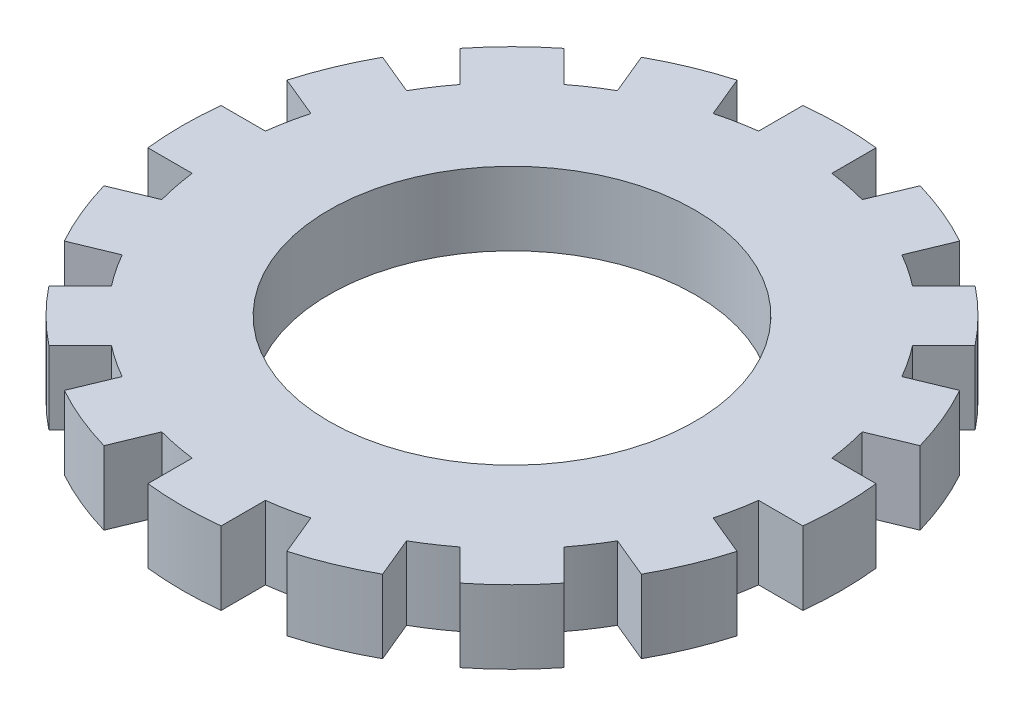
from build123d import *

# Parameters (mm, degrees)
SKETCH1_R           = 25
BOSS_EXTRUDE2_DEPTH = 10
SKETCH2_R           = 25
CUT_EXTRUDE1_DEPTH  = 10


with BuildPart() as part:
    # Sketch1 → Boss-Extrude2 (new body)
    # profile 1 of 17: a face of its own
    with BuildSketch(Plane(origin=(0, 0, 0), x_dir=(1, 0, 0), z_dir=(0, 1, 0))):
        with BuildLine():
            ThreePointArc((30.885122568, -23.814054756), (32.42731488, -21.667239088), (33.820542489, -19.420888387))
            ThreePointArc((33.820542489, -19.420888387), (36.031301768, -14.924653862), (37.647376813, -10.182093062))
            ThreePointArc((37.647376813, -10.182093062), (38.250625936, -7.608522559), (38.678159212, -5))
            ThreePointArc((38.678159212, -5), (39, 0), (38.678159212, 5))
            ThreePointArc((38.678159212, 5), (38.250625936, 7.608522559), (37.647376813, 10.182093062))
            ThreePointArc((37.647376813, 10.182093062), (36.031301768, 14.924653862), (33.820542489, 19.420888387))
            ThreePointArc((33.820542489, 19.420888387), (32.42731488, 21.667239088), (30.885122568, 23.814054756))
            ThreePointArc((30.885122568, 23.814054756), (27.577164466, 27.577164466), (23.814054756, 30.885122568))
            ThreePointArc((23.814054756, 30.885122568), (21.667239088, 32.42731488), (19.420888387, 33.820542489))
            ThreePointArc((19.420888387, 33.820542489), (14.924653862, 36.031301768), (10.182093062, 37.647376813))
            ThreePointArc((10.182093062, 37.647376813), (7.608522559, 38.250625936), (5, 38.678159212))
            ThreePointArc((5, 38.678159212), (0, 39), (-5, 38.678159212))
            ThreePointArc((-5, 38.678159212), (-7.608522559, 38.250625936), (-10.182093062, 37.647376813))
            ThreePointArc((-10.182093062, 37.647376813), (-14.924653862, 36.031301768), (-19.420888387, 33.820542489))
            ThreePointArc((-19.420888387, 33.820542489), (-21.667239088, 32.42731488), (-23.814054756, 30.885122568))
            ThreePointArc((-23.814054756, 30.885122568), (-27.577164466, 27.577164466), (-30.885122568, 23.814054756))
            ThreePointArc((-30.885122568, 23.814054756), (-32.42731488, 21.667239088), (-33.820542489, 19.420888387))
            ThreePointArc((-33.820542489, 19.420888387), (-36.031301768, 14.924653862), (-37.647376813, 10.182093062))
            ThreePointArc((-37.647376813, 10.182093062), (-38.250625936, 7.608522559), (-38.678159212, 5))
            ThreePointArc((-38.678159212, 5), (-39, 0), (-38.678159212, -5))
            ThreePointArc((-38.678159212, -5), (-38.250625936, -7.608522559), (-37.647376813, -10.182093062))
            ThreePointArc((-37.647376813, -10.182093062), (-36.031301768, -14.924653862), (-33.820542489, -19.420888387))
            ThreePointArc((-33.820542489, -19.420888387), (-32.42731488, -21.667239088), (-30.885122568, -23.814054756))
            ThreePointArc((-30.885122568, -23.814054756), (-27.577164466, -27.577164466), (-23.814054756, -30.885122568))
            ThreePointArc((-23.814054756, -30.885122568), (-21.667239088, -32.42731488), (-19.420888387, -33.820542489))
            ThreePointArc((-19.420888387, -33.820542489), (-14.924653862, -36.031301768), (-10.182093062, -37.647376813))
            ThreePointArc((-10.182093062, -37.647376813), (-7.608522559, -38.250625936), (-5, -38.678159212))
            ThreePointArc((-5, -38.678159212), (0, -39), (5, -38.678159212))
            ThreePointArc((5, -38.678159212), (7.608522559, -38.250625936), (10.182093062, -37.647376813))
            ThreePointArc((10.182093062, -37.647376813), (14.924653862, -36.031301768), (19.420888387, -33.820542489))
            ThreePointArc((19.420888387, -33.820542489), (21.667239088, -32.42731488), (23.814054756, -30.885122568))
            ThreePointArc((23.814054756, -30.885122568), (27.577164466, -27.577164466), (30.885122568, -23.814054756))
        make_face()
        Circle(SKETCH1_R, mode=Mode.SUBTRACT)
    # profile 2 of 17: a face of its own
    with BuildSketch(Plane(origin=(0, 0, 0), x_dir=(1, 0, 0), z_dir=(0, 1, 0))):
        with BuildLine():
            Line((-43.230565916, 12.49472571), (-37.647376813, 10.182093062))
            ThreePointArc((-37.647376813, 10.182093062), (-36.031301768, 14.924653862), (-33.820542489, 19.420888387))
            Line((-33.820542489, 19.420888387), (-39.403731592, 21.733521035))
            ThreePointArc((-39.403731592, 21.733521035), (-41.574578963, 17.220754456), (-43.230565916, 12.49472571))
        make_face()
    # profile 3 of 17: a face of its own
    with BuildSketch(Plane(origin=(0, 0, 0), x_dir=(1, 0, 0), z_dir=(0, 1, 0))):
        with BuildLine():
            ThreePointArc((-30.885122568, 23.814054756), (-27.577164466, 27.577164466), (-23.814054756, 30.885122568))
            Line((-23.814054756, 30.885122568), (-28.087242696, 35.158310508))
            ThreePointArc((-28.087242696, 35.158310508), (-31.819805153, 31.819805153), (-35.158310508, 28.087242696))
            Line((-35.158310508, 28.087242696), (-30.885122568, 23.814054756))
        make_face()
    # profile 4 of 17: a face of its own
    with BuildSketch(Plane(origin=(0, 0, 0), x_dir=(1, 0, 0), z_dir=(0, 1, 0))):
        with BuildLine():
            ThreePointArc((-19.420888387, 33.820542489), (-14.924653862, 36.031301768), (-10.182093062, 37.647376813))
            Line((-10.182093062, 37.647376813), (-12.49472571, 43.230565916))
            ThreePointArc((-12.49472571, 43.230565916), (-17.220754456, 41.574578963), (-21.733521035, 39.403731592))
            Line((-21.733521035, 39.403731592), (-19.420888387, 33.820542489))
        make_face()
    # profile 5 of 17: a face of its own
    with BuildSketch(Plane(origin=(0, 0, 0), x_dir=(1, 0, 0), z_dir=(0, 1, 0))):
        with BuildLine():
            ThreePointArc((-5, 38.678159212), (0, 39), (5, 38.678159212))
            Line((5, 38.678159212), (5, 44.72135955))
            ThreePointArc((5, 44.72135955), (0, 45), (-5, 44.72135955))
            Line((-5, 44.72135955), (-5, 38.678159212))
        make_face()
    # profile 6 of 17: a face of its own
    with BuildSketch(Plane(origin=(0, 0, 0), x_dir=(1, 0, 0), z_dir=(0, 1, 0))):
        with BuildLine():
            ThreePointArc((10.182093062, 37.647376813), (14.924653862, 36.031301768), (19.420888387, 33.820542489))
            Line((19.420888387, 33.820542489), (21.733521035, 39.403731592))
            ThreePointArc((21.733521035, 39.403731592), (17.220754456, 41.574578963), (12.49472571, 43.230565916))
            Line((12.49472571, 43.230565916), (10.182093062, 37.647376813))
        make_face()
    # profile 7 of 17: a face of its own
    with BuildSketch(Plane(origin=(0, 0, 0), x_dir=(1, 0, 0), z_dir=(0, 1, 0))):
        with BuildLine():
            ThreePointArc((33.820542489, 19.420888387), (36.031301768, 14.924653862), (37.647376813, 10.182093062))
            Line((37.647376813, 10.182093062), (43.230565916, 12.49472571))
            ThreePointArc((43.230565916, 12.49472571), (41.574578963, 17.220754456), (39.403731592, 21.733521035))
            Line((39.403731592, 21.733521035), (33.820542489, 19.420888387))
        make_face()
    # profile 8 of 17: a face of its own
    with BuildSketch(Plane(origin=(0, 0, 0), x_dir=(1, 0, 0), z_dir=(0, 1, 0))):
        with BuildLine():
            ThreePointArc((38.678159212, 5), (39, 0), (38.678159212, -5))
            Line((38.678159212, -5), (44.72135955, -5))
            ThreePointArc((44.72135955, -5), (45, 0), (44.72135955, 5))
            Line((44.72135955, 5), (38.678159212, 5))
        make_face()
    # profile 9 of 17: a face of its own
    with BuildSketch(Plane(origin=(0, 0, 0), x_dir=(1, 0, 0), z_dir=(0, 1, 0))):
        with BuildLine():
            ThreePointArc((37.647376813, -10.182093062), (36.031301768, -14.924653862), (33.820542489, -19.420888387))
            Line((33.820542489, -19.420888387), (39.403731592, -21.733521035))
            ThreePointArc((39.403731592, -21.733521035), (41.574578963, -17.220754456), (43.230565916, -12.49472571))
            Line((43.230565916, -12.49472571), (37.647376813, -10.182093062))
        make_face()
    # profile 10 of 17: a face of its own
    with BuildSketch(Plane(origin=(0, 0, 0), x_dir=(1, 0, 0), z_dir=(0, 1, 0))):
        with BuildLine():
            Line((35.158310508, -28.087242696), (30.885122568, -23.814054756))
            ThreePointArc((30.885122568, -23.814054756), (27.577164466, -27.577164466), (23.814054756, -30.885122568))
            Line((23.814054756, -30.885122568), (28.087242696, -35.158310508))
            ThreePointArc((28.087242696, -35.158310508), (31.819805153, -31.819805153), (35.158310508, -28.087242696))
        make_face()
    # profile 11 of 17: a face of its own
    with BuildSketch(Plane(origin=(0, 0, 0), x_dir=(1, 0, 0), z_dir=(0, 1, 0))):
        with BuildLine():
            Line((21.733521035, -39.403731592), (19.420888387, -33.820542489))
            ThreePointArc((19.420888387, -33.820542489), (14.924653862, -36.031301768), (10.182093062, -37.647376813))
            Line((10.182093062, -37.647376813), (12.49472571, -43.230565916))
            ThreePointArc((12.49472571, -43.230565916), (17.220754456, -41.574578963), (21.733521035, -39.403731592))
        make_face()
    # profile 12 of 17: a face of its own
    with BuildSketch(Plane(origin=(0, 0, 0), x_dir=(1, 0, 0), z_dir=(0, 1, 0))):
        with BuildLine():
            Line((5, -44.72135955), (5, -38.678159212))
            ThreePointArc((5, -38.678159212), (0, -39), (-5, -38.678159212))
            Line((-5, -38.678159212), (-5, -44.72135955))
            ThreePointArc((-5, -44.72135955), (0, -45), (5, -44.72135955))
        make_face()
    # profile 13 of 17: a face of its own
    with BuildSketch(Plane(origin=(0, 0, 0), x_dir=(1, 0, 0), z_dir=(0, 1, 0))):
        with BuildLine():
            ThreePointArc((-44.72135955, 5), (-45, 0), (-44.72135955, -5))
            Line((-44.72135955, -5), (-38.678159212, -5))
            ThreePointArc((-38.678159212, -5), (39, 0), (-38.678159212, 5))
            Line((-38.678159212, 5), (-44.72135955, 5))
        make_face()
    # profile 14 of 17: a face of its own
    with BuildSketch(Plane(origin=(0, 0, 0), x_dir=(1, 0, 0), z_dir=(0, 1, 0))):
        with BuildLine():
            Line((30.885122568, 23.814054756), (35.158310508, 28.087242696))
            ThreePointArc((35.158310508, 28.087242696), (31.819805153, 31.819805153), (28.087242696, 35.158310508))
            Line((28.087242696, 35.158310508), (23.814054756, 30.885122568))
            ThreePointArc((23.814054756, 30.885122568), (-27.577164466, -27.577164466), (30.885122568, 23.814054756))
        make_face()
    # profile 15 of 17: a face of its own
    with BuildSketch(Plane(origin=(0, 0, 0), x_dir=(1, 0, 0), z_dir=(0, 1, 0))):
        with BuildLine():
            Line((-37.647376813, -10.182093062), (-43.230565916, -12.49472571))
            ThreePointArc((-43.230565916, -12.49472571), (-41.574578963, -17.220754456), (-39.403731592, -21.733521035))
            Line((-39.403731592, -21.733521035), (-33.820542489, -19.420888387))
            ThreePointArc((-33.820542489, -19.420888387), (36.031301768, 14.924653862), (-37.647376813, -10.182093062))
        make_face()
    # profile 16 of 17: a face of its own
    with BuildSketch(Plane(origin=(0, 0, 0), x_dir=(1, 0, 0), z_dir=(0, 1, 0))):
        with BuildLine():
            Line((-30.885122568, -23.814054756), (-35.158310508, -28.087242696))
            ThreePointArc((-35.158310508, -28.087242696), (-31.819805153, -31.819805153), (-28.087242696, -35.158310508))
            Line((-28.087242696, -35.158310508), (-23.814054756, -30.885122568))
            ThreePointArc((-23.814054756, -30.885122568), (27.577164466, 27.577164466), (-30.885122568, -23.814054756))
        make_face()
    # profile 17 of 17: a face of its own
    with BuildSketch(Plane(origin=(0, 0, 0), x_dir=(1, 0, 0), z_dir=(0, 1, 0))):
        with BuildLine():
            Line((-19.420888387, -33.820542489), (-21.733521035, -39.403731592))
            ThreePointArc((-21.733521035, -39.403731592), (-17.220754456, -41.574578963), (-12.49472571, -43.230565916))
            Line((-12.49472571, -43.230565916), (-10.182093062, -37.647376813))
            ThreePointArc((-10.182093062, -37.647376813), (14.924653862, 36.031301768), (-19.420888387, -33.820542489))
        make_face()
    extrude(amount=-BOSS_EXTRUDE2_DEPTH)

    # Sketch2 → Cut-Extrude1 (cut)
    with BuildSketch(Plane.XZ.offset(10)):
        with Locations(Location((0, 0, 0), (0, 0, 270))):
            Circle(SKETCH2_R)
    extrude(amount=-CUT_EXTRUDE1_DEPTH, mode=Mode.SUBTRACT)


solid = part.part
